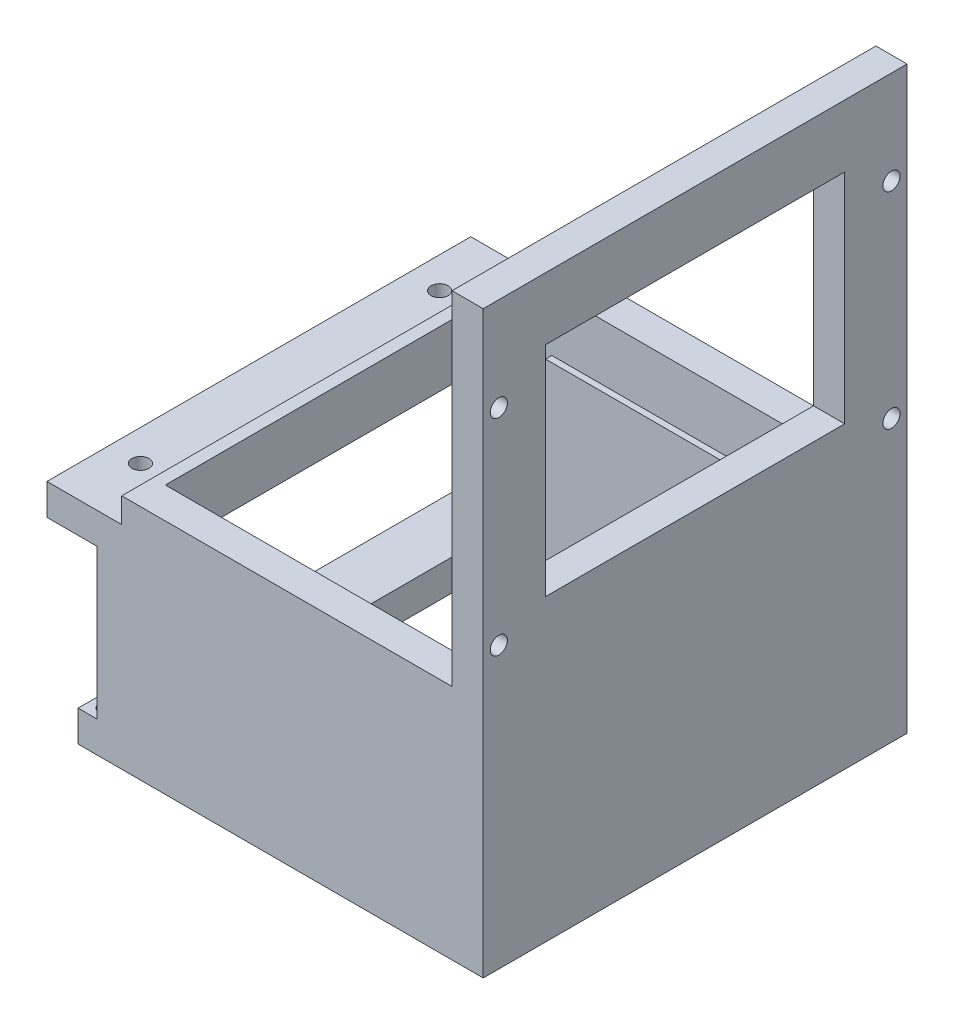
from build123d import *

# Parameters (mm, degrees)
SKETCH1_W           = 58
SKETCH1_H           = 68
BOSS_EXTRUDE1_DEPTH = 4
SKETCH2_W           = 5
SKETCH2_H           = 68
BOSS_EXTRUDE2_DEPTH = 55
SKETCH3_W           = 70
SKETCH3_H           = 68
BOSS_EXTRUDE3_DEPTH = 5
CUT_EXTRUDE1_REACH  = 85.265
SKETCH4_R           = 1.375
CUT_EXTRUDE2_REACH  = 99.658
SKETCH5_R           = 1.375
SKETCH5_W           = 48
SKETCH5_H           = 35
CUT_EXTRUDE4_REACH  = 78.564
SKETCH6_W           = 46
SKETCH6_H           = 58
SKETCH7_W           = 62
SKETCH7_H           = 68
SKETCH7_W_2         = 50
SKETCH7_H_2         = 56
BOSS_EXTRUDE4_DEPTH = 24
SKETCH8_W           = 65
SKETCH8_H           = 68
SKETCH8_R           = 1.5
BOSS_EXTRUDE5_DEPTH = 5
SKETCH9_W           = 50
SKETCH9_H           = 56
CUT_EXTRUDE5_DEPTH  = 10
SKETCH10_W          = 58
SKETCH10_H          = 24
CUT_EXTRUDE6_DEPTH  = 10


with BuildPart() as part:
    # Sketch1 → Boss-Extrude1 (new body)
    with BuildSketch(Plane(origin=(0, 0, 0), x_dir=(1, 0, 0), z_dir=(0, 1, 0))):
        Rectangle(SKETCH1_W, SKETCH1_H)
    extrude(amount=BOSS_EXTRUDE1_DEPTH)

    # Sketch2 → Boss-Extrude2 (add)
    with BuildSketch(Plane(origin=(0, 4, 0), x_dir=(1, 0, 0), z_dir=(0, 1, 0))):
        with Locations((26.5, 0)):
            Rectangle(SKETCH2_W, SKETCH2_H)
    extrude(amount=BOSS_EXTRUDE2_DEPTH)

    # Sketch3 → Boss-Extrude3 (add)
    with BuildSketch(Plane.XZ):
        with Locations((-6, 0)):
            Rectangle(SKETCH3_W, SKETCH3_H)
    extrude(amount=BOSS_EXTRUDE3_DEPTH)

    # Sketch4 → Cut-Extrude1 (cut, up to next)
    with BuildSketch(Plane.XZ.offset(5), mode=Mode.PRIVATE) as cut_extrude1_sk1:
        with Locations(Location((-36, 24, 0), (0, 0, 270))):
            Circle(SKETCH4_R)
    cut_extrude1_tool1 = extrude(cut_extrude1_sk1.sketch, amount=-CUT_EXTRUDE1_REACH, mode=Mode.PRIVATE) & part.part
    # Sketch4 → Cut-Extrude1 (cut, up to next)
    with BuildSketch(Plane.XZ.offset(5), mode=Mode.PRIVATE) as cut_extrude1_sk2:
        with Locations(Location((-36, -24, 0), (0, 0, 90))):
            Circle(SKETCH4_R)
    cut_extrude1_tool2 = extrude(cut_extrude1_sk2.sketch, amount=-CUT_EXTRUDE1_REACH, mode=Mode.PRIVATE) & part.part
    add(cut_extrude1_tool1.solids().sort_by_distance((-36, -5, 24))[0], mode=Mode.SUBTRACT)
    add(cut_extrude1_tool2.solids().sort_by_distance((-36, -5, -24))[0], mode=Mode.SUBTRACT)

    # Sketch5 → Cut-Extrude2 (cut, up to next)
    with BuildSketch(Plane(origin=(29, 0, 0), x_dir=(0, 0, -1), z_dir=(1, 0, 0)), mode=Mode.PRIVATE) as cut_extrude2_sk1:
        with Locations((-31.5, 44)):
            Circle(SKETCH5_R)
    cut_extrude2_tool1 = extrude(cut_extrude2_sk1.sketch, amount=-CUT_EXTRUDE2_REACH, mode=Mode.PRIVATE) & part.part
    # Sketch5 → Cut-Extrude2 (cut, up to next)
    with BuildSketch(Plane(origin=(29, 0, 0), x_dir=(0, 0, -1), z_dir=(1, 0, 0)), mode=Mode.PRIVATE) as cut_extrude2_sk2:
        with Locations((-31.5, 11)):
            Circle(SKETCH5_R)
    cut_extrude2_tool2 = extrude(cut_extrude2_sk2.sketch, amount=-CUT_EXTRUDE2_REACH, mode=Mode.PRIVATE) & part.part
    # Sketch5 → Cut-Extrude2 (cut, up to next)
    with BuildSketch(Plane(origin=(29, 0, 0), x_dir=(0, 0, -1), z_dir=(1, 0, 0)), mode=Mode.PRIVATE) as cut_extrude2_sk3:
        with Locations((31.5, 11)):
            Circle(SKETCH5_R)
    cut_extrude2_tool3 = extrude(cut_extrude2_sk3.sketch, amount=-CUT_EXTRUDE2_REACH, mode=Mode.PRIVATE) & part.part
    # Sketch5 → Cut-Extrude2 (cut, up to next)
    with BuildSketch(Plane(origin=(29, 0, 0), x_dir=(0, 0, -1), z_dir=(1, 0, 0)), mode=Mode.PRIVATE) as cut_extrude2_sk4:
        with Locations((31.5, 44)):
            Circle(SKETCH5_R)
    cut_extrude2_tool4 = extrude(cut_extrude2_sk4.sketch, amount=-CUT_EXTRUDE2_REACH, mode=Mode.PRIVATE) & part.part
    # Sketch5 → Cut-Extrude2 (cut, up to next)
    with BuildSketch(Plane(origin=(29, 0, 0), x_dir=(0, 0, -1), z_dir=(1, 0, 0)), mode=Mode.PRIVATE) as cut_extrude2_sk5:
        with Locations((0, 31.5)):
            Rectangle(SKETCH5_W, SKETCH5_H)
    cut_extrude2_tool5 = extrude(cut_extrude2_sk5.sketch, amount=-CUT_EXTRUDE2_REACH, mode=Mode.PRIVATE) & part.part
    add(cut_extrude2_tool1.solids().sort_by_distance((29, 44, 31.5))[0], mode=Mode.SUBTRACT)
    add(cut_extrude2_tool2.solids().sort_by_distance((29, 11, 31.5))[0], mode=Mode.SUBTRACT)
    add(cut_extrude2_tool3.solids().sort_by_distance((29, 11, -31.5))[0], mode=Mode.SUBTRACT)
    add(cut_extrude2_tool4.solids().sort_by_distance((29, 44, -31.5))[0], mode=Mode.SUBTRACT)
    add(cut_extrude2_tool5.solids().sort_by_distance((29, 31.5, 0))[0], mode=Mode.SUBTRACT)

    # Sketch6 → Cut-Extrude4 (cut, up to next)
    with BuildSketch(Plane(origin=(0, 4, 0), x_dir=(1, 0, 0), z_dir=(0, 1, 0)), mode=Mode.PRIVATE) as cut_extrude4_sk1:
        with Locations((-4, 0)):
            Rectangle(SKETCH6_W, SKETCH6_H)
    cut_extrude4_tool1 = extrude(cut_extrude4_sk1.sketch, amount=-CUT_EXTRUDE4_REACH, mode=Mode.PRIVATE) & part.part
    add(cut_extrude4_tool1.solids().sort_by_distance((-4, 4, 0))[0], mode=Mode.SUBTRACT)

    # Sketch7 → Boss-Extrude4 (add)
    with BuildSketch(Plane.XZ.offset(5)):
        with Locations((-2, 0)):
            Rectangle(SKETCH7_W, SKETCH7_H)
        with Locations((-2, 0)):
            Rectangle(SKETCH7_W_2, SKETCH7_H_2, mode=Mode.SUBTRACT)
    extrude(amount=BOSS_EXTRUDE4_DEPTH)

    # Sketch8 → Boss-Extrude5 (add)
    with BuildSketch(Plane.XZ.offset(29)):
        with Locations((-3.5, 0)):
            Rectangle(SKETCH8_W, SKETCH8_H)
        with Locations(Location((26.5, -31.5, 0), (0, 0, 270))):
            Circle(SKETCH8_R, mode=Mode.SUBTRACT)
        with Locations(Location((-33.5, -31.5, 0), (0, 0, 70.528779366))):
            Circle(SKETCH8_R, mode=Mode.SUBTRACT)
        with Locations(Location((-33.5, 31.5, 0), (0, 0, 70.528779366))):
            Circle(SKETCH8_R, mode=Mode.SUBTRACT)
        with Locations(Location((26.5, 31.5, 0), (0, 0, 270))):
            Circle(SKETCH8_R, mode=Mode.SUBTRACT)
        with Locations(Location((-3.5, 0, 0), (0, 0, 270))):
            Circle(SKETCH8_R, mode=Mode.SUBTRACT)
    extrude(amount=BOSS_EXTRUDE5_DEPTH)

    # Sketch9 → Cut-Extrude5 (cut)
    with BuildSketch(Plane(origin=(0, -29, 0), x_dir=(1, 0, 0), z_dir=(0, 1, 0))):
        with Locations((-2, 0)):
            Rectangle(SKETCH9_W, SKETCH9_H)
    extrude(amount=-CUT_EXTRUDE5_DEPTH, mode=Mode.SUBTRACT)

    # Sketch10 → Cut-Extrude6 (cut)
    with BuildSketch(Plane.ZY.offset(33)):
        with Locations((0, -17)):
            Rectangle(SKETCH10_W, SKETCH10_H)
    extrude(amount=-CUT_EXTRUDE6_DEPTH, mode=Mode.SUBTRACT)


solid = part.part
